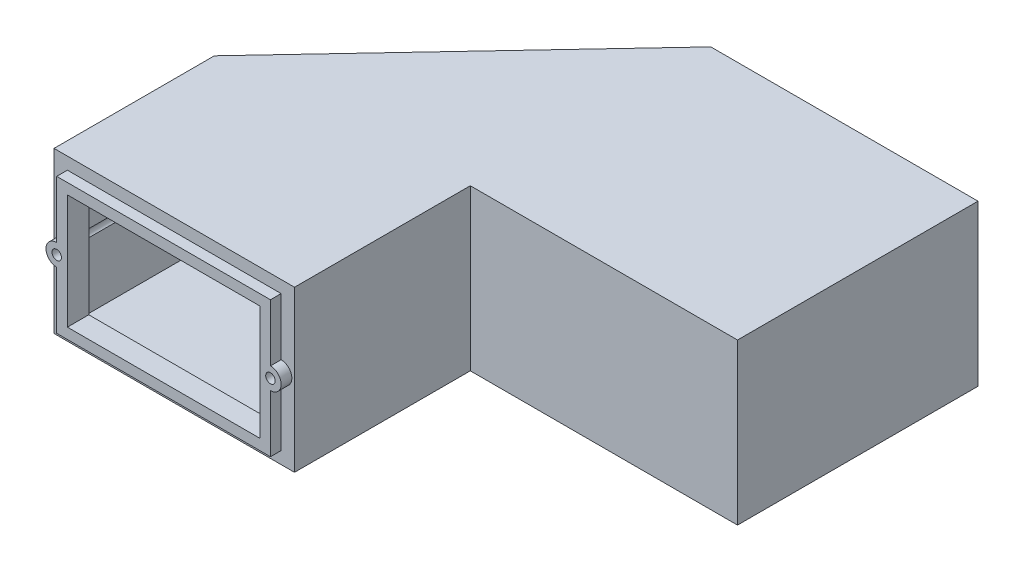
from build123d import *

# Parameters (mm, degrees)
BOSS_EXTRUDE1_DEPTH       = 38.1
SKETCH3_W                 = 50.8
SKETCH3_H                 = 32.3088
BOSS_EXTRUDE2_DEPTH       = 2.54
SHELL2_T                  = -2.54
SKETCH5_R                 = 2.54
BOSS_EXTRUDE3_DEPTH       = 2.54
F_4_40_TAPPED_HOLE1_D     = 2.2606
F_4_40_TAPPED_HOLE1_DEPTH = 98.926014438
F_4_40_TAPPED_HOLE1_TIP   = 0.679152758
CUT_EXTRUDE1_DEPTH        = 2.54
CIRPATTERN1_COUNT         = 4


with BuildPart() as part:
    # Sketch1 → Boss-Extrude1 (new body)
    with BuildSketch(Plane(origin=(0, 0, 0), x_dir=(1, 0, 0), z_dir=(0, 1, 0))):
        Polygon((0, 0), (57.15, 0), (57.15, 41.777014438), (120.65, 41.777014438), (120.65, 98.927014438), (57.15, 98.927014438), (0, 38.1), align=None)
    extrude(amount=BOSS_EXTRUDE1_DEPTH)

    # Sketch3 → Boss-Extrude2 (add)
    with BuildSketch(Plane.XY):
        with Locations((28.575, 19.05)):
            Rectangle(SKETCH3_W, SKETCH3_H)
    extrude(amount=BOSS_EXTRUDE2_DEPTH)

    # Shell2
    shell2_openings = [part.faces().sort_by_distance(p)[0] for p in [
        (28.575, 19.05, 2.54),
    ]]
    offset(amount=SHELL2_T, openings=shell2_openings, kind=Kind.INTERSECTION)

    # Sketch5 → Boss-Extrude3 (add)
    with BuildSketch(Plane.XY.offset(2.54)):
        with Locations((3.175, 19.05)):
            Circle(SKETCH5_R)
        with Locations((53.975, 19.05)):
            Circle(SKETCH5_R)
    extrude(amount=-BOSS_EXTRUDE3_DEPTH)

    # #4-40 Tapped Hole1
    with Locations(Plane(origin=(53.975, 19.05, 2.54), x_dir=(1, 0, 0), z_dir=(0, 0, 1))):
        with Locations((0, 0), (-50.8, 0)):
            Hole(F_4_40_TAPPED_HOLE1_D / 2, depth=F_4_40_TAPPED_HOLE1_DEPTH)
            with Locations((0, 0, -(F_4_40_TAPPED_HOLE1_DEPTH + F_4_40_TAPPED_HOLE1_TIP / 2))):  # 118° drill point
                Cone(0, F_4_40_TAPPED_HOLE1_D / 2, F_4_40_TAPPED_HOLE1_TIP, mode=Mode.SUBTRACT)

    # single button hole → Cut-Extrude1 (cut)
    with BuildSketch(Plane(origin=(0, 0, -98.927014438), x_dir=(-1, 0, 0), z_dir=(0, 0, -1))):
        with BuildLine():
            Line((-93.345, 10.668), (-97.155, 10.668))
            ThreePointArc((-97.155, 10.668), (-99.187, 12.7), (-97.155, 14.732))
            Line((-97.155, 14.732), (-93.345, 14.732))
            ThreePointArc((-93.345, 14.732), (-91.313, 12.7), (-93.345, 10.668))
        make_face()
    cut_extrude1 = extrude(amount=-CUT_EXTRUDE1_DEPTH, mode=Mode.SUBTRACT)

    # CirPattern1: Cut-Extrude1 ×4 about axis
    cirpattern1_axis = Axis((95.25, 19.05, 0), (0, 0, 1))
    for i in range(1, CIRPATTERN1_COUNT):
        add(cut_extrude1.rotate(cirpattern1_axis, i * 360 / CIRPATTERN1_COUNT), mode=Mode.SUBTRACT)


solid = part.part
